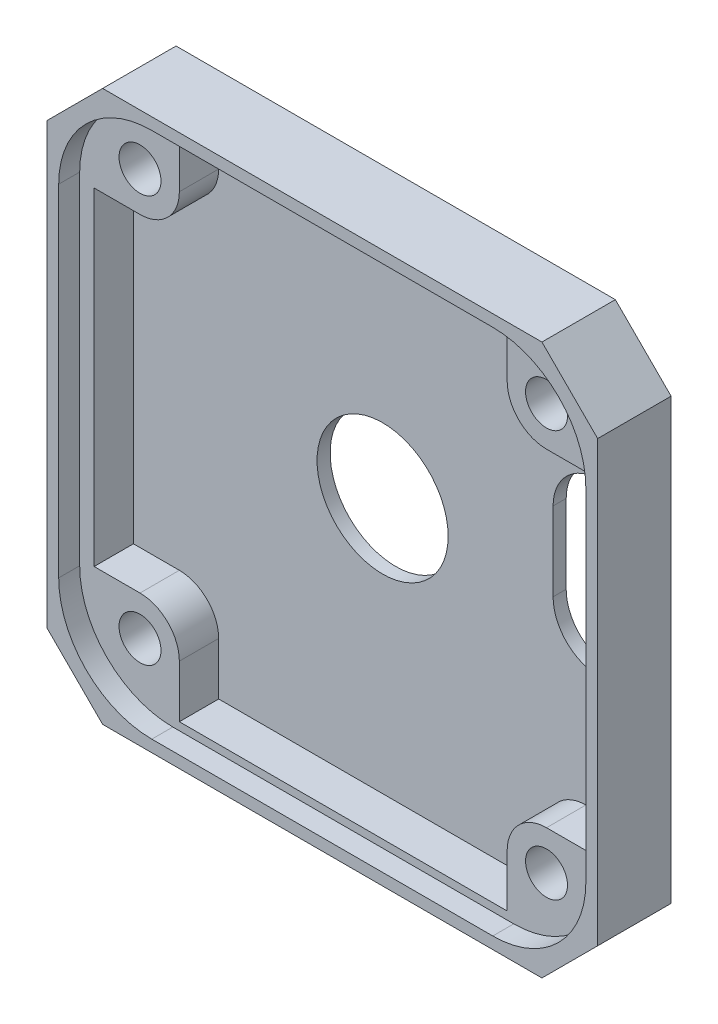
from build123d import *

# Parameters (mm, degrees)
SKETCH_1_R      = 5
SKETCH_1_R_2    = 1.6
EXTRUDE_3_DEPTH = 1
SKETCH_3_R      = 1.6
EXTRUDE_4_DEPTH = 3
EXTRUDE_5_DEPTH = 1.6


with BuildPart() as part:
    # 草图1 → 凸台-拉伸3 (new body)
    with BuildSketch(Plane.XY):
        Polygon((-21, 16.75), (-21, -16.75), (-16.75, -21), (16.75, -21), (21, -16.75), (21, 16.75), (16.75, 21), (-16.75, 21), align=None)
        Circle(SKETCH_1_R, mode=Mode.SUBTRACT)
        with Locations((-15.5, 15.5)):
            Circle(SKETCH_1_R_2, mode=Mode.SUBTRACT)
        with Locations((15.5, 15.5)):
            Circle(SKETCH_1_R_2, mode=Mode.SUBTRACT)
        with Locations((-15.5, -15.5)):
            Circle(SKETCH_1_R_2, mode=Mode.SUBTRACT)
        with Locations((15.5, -15.5)):
            Circle(SKETCH_1_R_2, mode=Mode.SUBTRACT)
        with BuildLine():
            Line((13, 6), (13, 0))
            ThreePointArc((13, 0), (14.025126266, -2.474873734), (16.5, -3.5))
            Line((16.5, -3.5), (20, -3.5))
            Line((20, -3.5), (20, 9.5))
            Line((20, 9.5), (16.5, 9.5))
            ThreePointArc((16.5, 9.5), (14.025126266, 8.474873734), (13, 6))
        make_face(mode=Mode.SUBTRACT)
    extrude(amount=EXTRUDE_3_DEPTH)

    # 草图3 → 凸台-拉伸4 (add)
    with BuildSketch(Plane.XY.offset(1)):
        Polygon((-16.75, 21), (-21, 16.75), (-21, -16.75), (-16.75, -21), (16.75, -21), (21, -16.75), (21, 16.75), (16.75, 21), align=None)
        with Locations((-15.5, 15.5)):
            Circle(SKETCH_3_R, mode=Mode.SUBTRACT)
        with Locations((15.5, 15.5)):
            Circle(SKETCH_3_R, mode=Mode.SUBTRACT)
        with Locations((-15.5, -15.5)):
            Circle(SKETCH_3_R, mode=Mode.SUBTRACT)
        with Locations((15.5, -15.5)):
            Circle(SKETCH_3_R, mode=Mode.SUBTRACT)
        with BuildLine():
            Line((-12.5, 15.5), (-12.5, 19.5))
            Line((-12.5, 19.5), (12.5, 19.5))
            Line((12.5, 19.5), (12.5, 15.5))
            ThreePointArc((12.5, 15.5), (13.378679656, 13.378679656), (15.5, 12.5))
            Line((15.5, 12.5), (19, 12.5))
            Line((19, 12.5), (19, 9.5))
            Line((19, 9.5), (20, 9.5))
            Line((20, 9.5), (20, -3.5))
            Line((20, -3.5), (19, -3.5))
            Line((19, -3.5), (19, -12.5))
            Line((19, -12.5), (15.5, -12.5))
            ThreePointArc((15.5, -12.5), (13.378679656, -13.378679656), (12.5, -15.5))
            Line((12.5, -15.5), (12.5, -19.5))
            Line((12.5, -19.5), (-12.5, -19.5))
            Line((-12.5, -19.5), (-12.5, -15.5))
            ThreePointArc((-12.5, -15.5), (-13.378679656, -13.378679656), (-15.5, -12.5))
            Line((-15.5, -12.5), (-19, -12.5))
            Line((-19, -12.5), (-19, 12.5))
            Line((-19, 12.5), (-15.5, 12.5))
            ThreePointArc((-15.5, 12.5), (-13.378679656, 13.378679656), (-12.5, 15.5))
        make_face(mode=Mode.SUBTRACT)
    extrude(amount=EXTRUDE_4_DEPTH)

    # 草图4 → 凸台-拉伸5 (add)
    with BuildSketch(Plane.XY.offset(4)):
        Polygon((-16.75, 21), (-21, 16.75), (-21, -16.75), (-16.75, -21), (16.75, -21), (21, -16.75), (21, 16.75), (16.75, 21), align=None)
        with BuildLine():
            Line((-20.1, 13), (-20.1, -13))
            ThreePointArc((-20.1, -13), (-18.020458146, -18.020458146), (-13, -20.1))
            Line((-13, -20.1), (13, -20.1))
            ThreePointArc((13, -20.1), (18.020458146, -18.020458146), (20.1, -13))
            Line((20.1, -13), (20.1, 13))
            ThreePointArc((20.1, 13), (18.020458146, 18.020458146), (13, 20.1))
            Line((13, 20.1), (-13, 20.1))
            ThreePointArc((-13, 20.1), (-18.020458146, 18.020458146), (-20.1, 13))
        make_face(mode=Mode.SUBTRACT)
    extrude(amount=EXTRUDE_5_DEPTH)


solid = part.part
